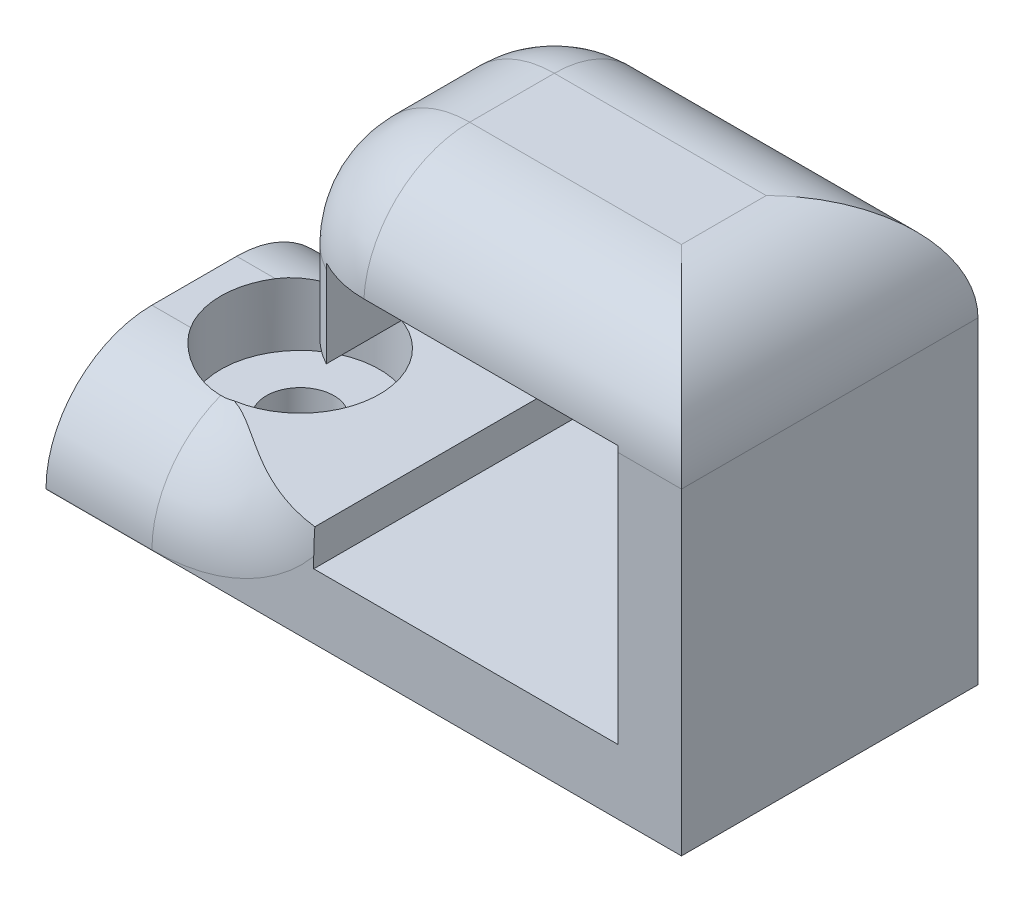
from build123d import *

# Parameters (mm, degrees)
SKETCH1_W               = 30
SKETCH1_H               = 14
BOSS_EXTRUDE1_DEPTH     = 20
SKETCH2_W               = 10
SKETCH2_H               = 14.981059247
CUT_EXTRUDE1_DEPTH      = 20
FILLET1_R               = 5
SKETCH3_W               = 16.938954743
SKETCH3_H               = 3.286131709
CUT_EXTRUDE2_DEPTH      = 20
SKETCH4_W               = 7.5
SKETCH4_H               = 10.24752105
CUT_EXTRUDE3_DEPTH      = 20
CUT_EXTRUDE5_DEPTH      = 20
CUT_EXTRUDE5_DEPTH_BACK = 20
SKETCH5_R               = 1.6
CUT_EXTRUDE6_DEPTH      = 5
CUT_EXTRUDE6_DEPTH_BACK = 3
SKETCH6_R               = 3.75
SKETCH8_W               = 10.467205443
SKETCH8_H               = 5.426445144
CUT_EXTRUDE8_DEPTH      = 20
SKETCH9_W               = 2.170946208
SKETCH9_H               = 10.24752105
CUT_EXTRUDE9_DEPTH      = 20
SKETCH10_W              = 14.357250264
SKETCH10_H              = 12.211649431
CUT_EXTRUDE12_DEPTH     = 20


with BuildPart() as part:
    # Sketch1 → Boss-Extrude1 (new body)
    with BuildSketch(Plane(origin=(0, 0, 0), x_dir=(1, 0, 0), z_dir=(0, 1, 0))):
        with Locations((5.130024125, 0.849928215)):
            Rectangle(SKETCH1_W, SKETCH1_H)
    extrude(amount=BOSS_EXTRUDE1_DEPTH)

    # Sketch2 → Cut-Extrude1 (cut)
    with BuildSketch(Plane.XY.offset(6.150071785)):
        with Locations((-4.869975875, 12.509470377)):
            Rectangle(SKETCH2_W, SKETCH2_H)
    extrude(amount=-CUT_EXTRUDE1_DEPTH, mode=Mode.SUBTRACT)

    # Fillet1
    fillet1_edges = [part.edges().sort_by_distance(p)[0] for p in [
        (20.130024125, 20, -0.849928215),
        (10.130024125, 20, 6.150071785),
        (0.130024125, 20, -0.849928215),
        (-4.869975875, 5.018940753, -7.849928215),
        (10.130024125, 20, -7.849928215),
        (0.130024125, 5.018940753, -0.849928215),
        (0.130024125, 12.509470377, -7.849928215),
        (-4.869975875, 5.018940753, 6.150071785),
        (0.130024125, 12.509470377, 6.150071785),
    ]]
    fillet(fillet1_edges, radius=FILLET1_R)

    # Sketch3 → Cut-Extrude2 (cut)
    with BuildSketch(Plane(origin=(0, 0, -7.849928215), x_dir=(-1, 0, 0), z_dir=(0, 0, -1))):
        with Locations((-4.226478324, 9.498403921)):
            Rectangle(SKETCH3_W, SKETCH3_H)
    extrude(amount=-CUT_EXTRUDE2_DEPTH, mode=Mode.SUBTRACT)

    # Sketch4 → Cut-Extrude3 (cut)
    with BuildSketch(Plane(origin=(0, 0, -7.849928215), x_dir=(-1, 0, 0), z_dir=(0, 0, -1))):
        with Locations((-8.880024125, 9.876239475)):
            Rectangle(SKETCH4_W, SKETCH4_H)
    extrude(amount=-CUT_EXTRUDE3_DEPTH, mode=Mode.SUBTRACT)

    # Sketch5 → Cut-Extrude5 (cut, two sides: drawn at the far end of the back side and taken through both)
    with BuildSketch(Plane(origin=(0, 5.018940753, 0), x_dir=(1, 0, 0), z_dir=(0, 1, 0)).offset(-CUT_EXTRUDE5_DEPTH_BACK)):
        with Locations(Location((-4.869975875, 0.849928215, 0), (0, 0, 270))):
            Circle(SKETCH5_R)
    extrude(amount=CUT_EXTRUDE5_DEPTH + CUT_EXTRUDE5_DEPTH_BACK, mode=Mode.SUBTRACT)

    # Sketch6 → Cut-Extrude6 (cut, two sides: drawn at the far end of the back side and taken through both)
    with BuildSketch(Plane(origin=(0, 5.018940753, 0), x_dir=(1, 0, 0), z_dir=(0, 1, 0)).offset(-CUT_EXTRUDE6_DEPTH_BACK)):
        with Locations(Location((-4.869975875, 0.849928215, 0), (0, 0, 270))):
            Circle(SKETCH6_R)
    extrude(amount=CUT_EXTRUDE6_DEPTH + CUT_EXTRUDE6_DEPTH_BACK, mode=Mode.SUBTRACT)

    # Sketch8 → Cut-Extrude8 (cut)
    with BuildSketch(Plane(origin=(0, 0, -7.849928215), x_dir=(-1, 0, 0), z_dir=(0, 0, -1))):
        with Locations((0.103578597, 7.465701522)):
            Rectangle(SKETCH8_W, SKETCH8_H)
    extrude(amount=-CUT_EXTRUDE8_DEPTH, mode=Mode.SUBTRACT)

    # Sketch9 → Cut-Extrude9 (cut)
    with BuildSketch(Plane(origin=(0, 0, -7.849928215), x_dir=(-1, 0, 0), z_dir=(0, 0, -1))):
        with Locations((-13.715497229, 9.876239475)):
            Rectangle(SKETCH9_W, SKETCH9_H)
    extrude(amount=-CUT_EXTRUDE9_DEPTH, mode=Mode.SUBTRACT)

    # Sketch10 → Cut-Extrude12 (cut)
    with BuildSketch(Plane(origin=(0, 0, -7.849928215), x_dir=(-1, 0, 0), z_dir=(0, 0, -1))):
        with Locations((-9.948498564, 9.165448936)):
            Rectangle(SKETCH10_W, SKETCH10_H)
    extrude(amount=-CUT_EXTRUDE12_DEPTH, mode=Mode.SUBTRACT)


solid = part.part
